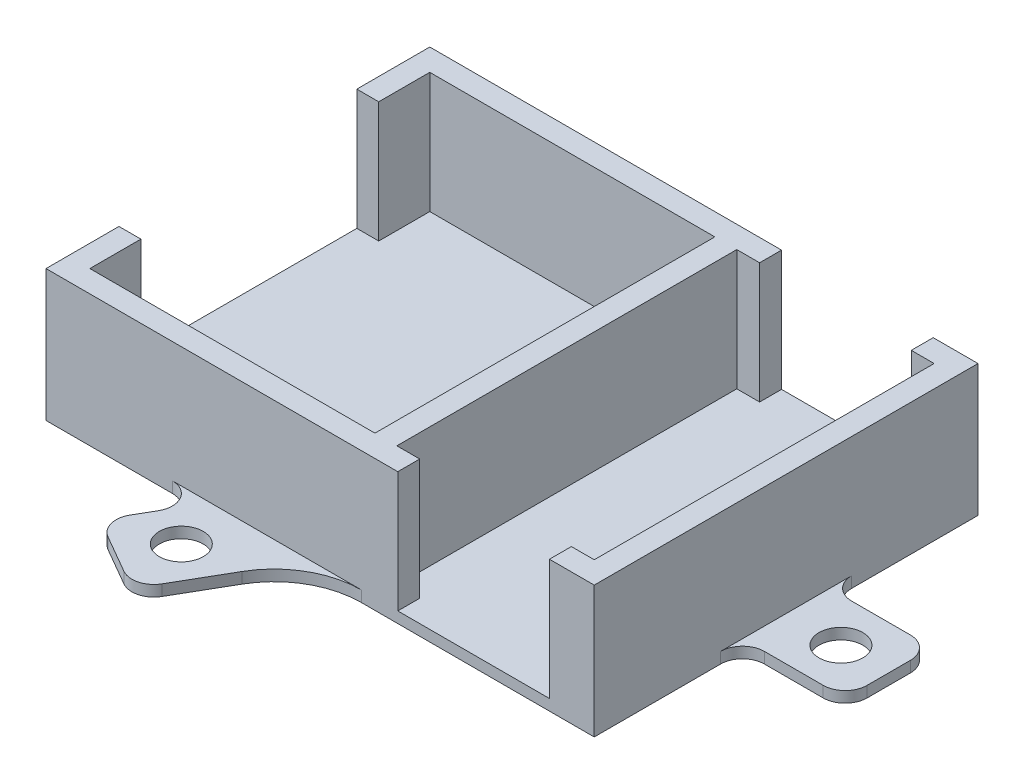
from build123d import *

# Parameters (mm, degrees)
BOSS_EXTRUDE1_DEPTH   = 11
BOSS_EXTRUDE1_2_DEPTH = 11
SKETCH2_R             = 2
BOSS_EXTRUDE2_DEPTH   = 1


with BuildPart() as part:
    # Sketch1 → Boss-Extrude1 (new body)
    with BuildSketch(Plane(origin=(0, 0, 0), x_dir=(1, 0, 0), z_dir=(0, 1, 0))):
        Polygon((-26.926443894, -15.5), (-0.926443894, -15.5), (-0.926443894, 15.5), (-26.926443894, 15.5), (-26.926443894, 10.846689955), (-28.926443894, 10.846689955), (-28.926443894, 17.5), (3.157388066, 17.5), (3.157388066, 15.5), (1.073556106, 15.5), (1.073556106, -15.5), (3.157388066, -15.5), (3.157388066, -17.5), (-28.926443894, -17.5), (-28.926443894, -10.846689955), (-26.926443894, -10.846689955), align=None)
    extrude(amount=BOSS_EXTRUDE1_DEPTH)



with BuildPart() as body_2:
    # Sketch1 → Boss-Extrude1 2 (new body)
    with BuildSketch(Plane(origin=(0, 0, 0), x_dir=(1, 0, 0), z_dir=(0, 1, 0))):
        Polygon((19.073556106, 15.5), (19.073556106, -15.5), (16.989724146, -15.5), (16.989724146, -17.5), (21.073556106, -17.5), (21.073556106, 17.5), (16.989724146, 17.5), (16.989724146, 15.5), align=None)
    extrude(amount=BOSS_EXTRUDE1_2_DEPTH)


with BuildPart() as part_1:
    add(part.part)

    add(body_2.part)  # Boss-Extrude2 merges body 2
    # Sketch2 → Boss-Extrude2 (add)
    with BuildSketch(Plane.XZ):
        with BuildLine():
            Line((-28.926443894, 17.5), (-17.408269171, 17.5))
            ThreePointArc((-17.408269171, 17.5), (-15.676218364, 18.5), (-15.676218364, 20.5))
            Line((-15.676218364, 20.5), (-16.624724435, 22.142860706))
            ThreePointArc((-16.624724435, 22.142860706), (-16.82452528, 23.660498796), (-15.892673627, 24.874911513))
            Line((-15.892673627, 24.874911513), (-12.469020781, 26.851558406))
            ThreePointArc((-12.469020781, 26.851558406), (-10.951382691, 27.051359251), (-9.736969974, 26.119507598))
            Line((-9.736969974, 26.119507598), (-7.056413095, 21.476646892))
            ThreePointArc((-7.056413095, 21.476646892), (-4.145305527, 18.565539323), (-0.168658635, 17.5))
            Line((-0.168658635, 17.5), (21.073556106, 17.5))
            Line((21.073556106, 17.5), (21.073556106, 5.976646892))
            ThreePointArc((21.073556106, 5.976646892), (21.659342544, 4.56243333), (23.073556106, 3.976646892))
            Line((23.073556106, 3.976646892), (28.434669863, 3.976646892))
            ThreePointArc((28.434669863, 3.976646892), (29.848883425, 3.390860454), (30.434669863, 1.976646892))
            Line((30.434669863, 1.976646892), (30.434669863, -1.976646892))
            ThreePointArc((30.434669863, -1.976646892), (29.848883425, -3.390860454), (28.434669863, -3.976646892))
            Line((28.434669863, -3.976646892), (23.073556106, -3.976646892))
            ThreePointArc((23.073556106, -3.976646892), (21.659342544, -4.56243333), (21.073556106, -5.976646892))
            Line((21.073556106, -5.976646892), (21.073556106, -17.5))
            Line((21.073556106, -17.5), (-0.864905973, -17.5))
            ThreePointArc((-0.864905973, -17.5), (-4.494457946, -18.60652774), (-7.146873061, -21.319965636))
            Line((-7.146873061, -21.319965636), (-9.827429939, -25.962826342))
            ThreePointArc((-9.827429939, -25.962826342), (-11.041842657, -26.894677994), (-12.559480747, -26.694877149))
            Line((-12.559480747, -26.694877149), (-15.983133593, -24.718230257))
            ThreePointArc((-15.983133593, -24.718230257), (-16.914985245, -23.50381754), (-16.7151844, -21.98617945))
            Line((-16.7151844, -21.98617945), (-15.857138295, -20.5))
            ThreePointArc((-15.857138295, -20.5), (-15.857138295, -18.5), (-17.589189102, -17.5))
            Line((-17.589189102, -17.5), (-28.926443894, -17.5))
            Line((-28.926443894, -17.5), (-28.926443894, 17.5))
        make_face()
        with Locations(Location((26.073556106, 0, 0), (0, 0, 270))):
            Circle(SKETCH2_R, mode=Mode.SUBTRACT)
        with Locations(Location((-12.090750291, -21.929718401, 0), (0, 0, 270))):
            Circle(SKETCH2_R, mode=Mode.SUBTRACT)
        with Locations(Location((-12.000290326, 22.086399657, 0), (0, 0, 270))):
            Circle(SKETCH2_R, mode=Mode.SUBTRACT)
    extrude(amount=BOSS_EXTRUDE2_DEPTH)


solid = part_1.part
